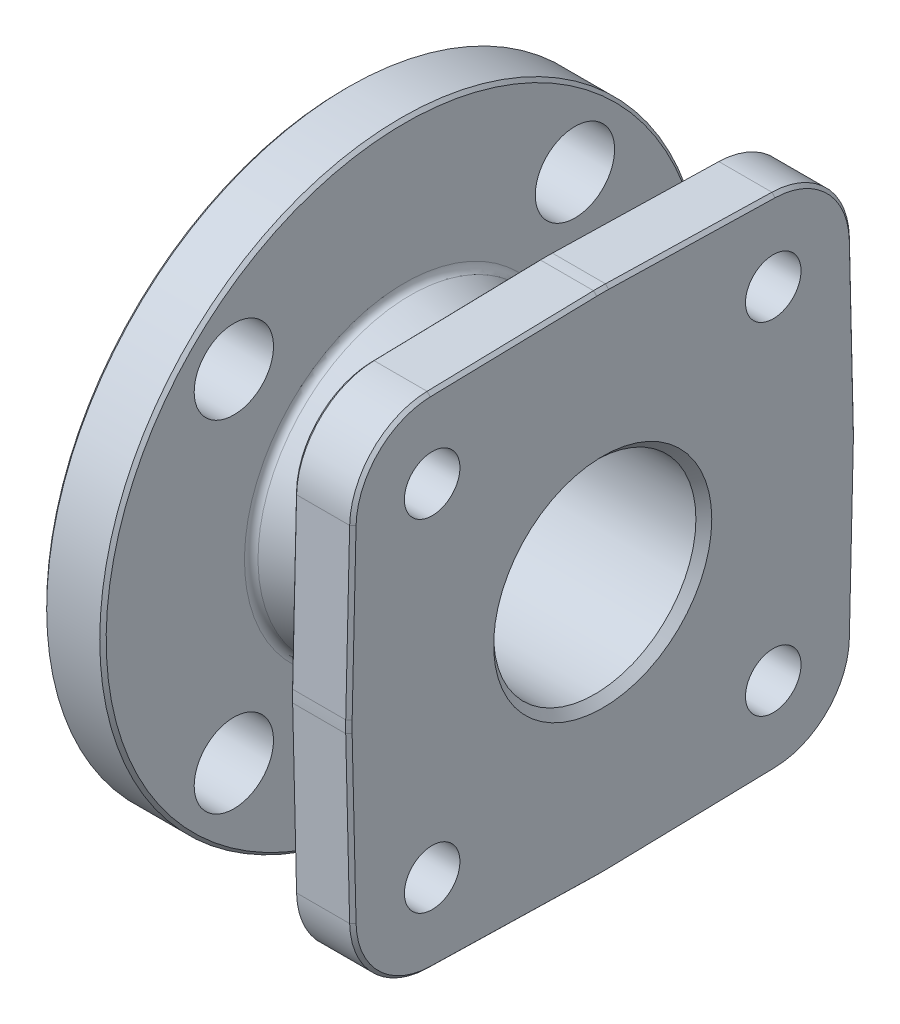
from build123d import *

# Parameters (mm, degrees)
BOSS_EXTRUDE1_DEPTH = 15
HOLE1_D             = 51
HOLE2_D             = 14
HOLE2_DEPTH         = 15
HOLE3_D             = 20
HOLE3_DEPTH         = 15
FILLET1_R           = 2
CHAMFER1_SIZE       = 0.81
CHAMFER2_SIZE       = 2


with BuildPart() as part:
    # Sketch1 → Boss-Extrude1 (new body)
    with BuildSketch(Plane(origin=(0, 0, 0), x_dir=(0, 0, -1), z_dir=(1, 0, 0))):
        with BuildLine():
            Line((-62.994461331, 43.470654948), (-63.982276259, 1.506095834))
            ThreePointArc((-63.982276259, 1.506095834), (-64, 0), (-63.982276259, -1.506095834))
            Line((-63.982276259, -1.506095834), (-62.994461331, -43.470654948))
            ThreePointArc((-62.994461331, -43.470654948), (-57.142135624, -57.142135624), (-43.470654948, -62.994461331))
            Line((-43.470654948, -62.994461331), (-1.506095834, -63.982276259))
            ThreePointArc((-1.506095834, -63.982276259), (0, -64), (1.506095834, -63.982276259))
            Line((1.506095834, -63.982276259), (43.470654948, -62.994461331))
            ThreePointArc((43.470654948, -62.994461331), (57.142135624, -57.142135624), (62.994461331, -43.470654948))
            Line((62.994461331, -43.470654948), (63.982276259, -1.506095834))
            ThreePointArc((63.982276259, -1.506095834), (64, 0), (63.982276259, 1.506095834))
            Line((63.982276259, 1.506095834), (62.994461331, 43.470654948))
            ThreePointArc((62.994461331, 43.470654948), (57.142135624, 57.142135624), (43.470654948, 62.994461331))
            Line((43.470654948, 62.994461331), (1.506095834, 63.982276259))
            ThreePointArc((1.506095834, 63.982276259), (0, 64), (-1.506095834, 63.982276259))
            Line((-1.506095834, 63.982276259), (-43.470654948, 62.994461331))
            ThreePointArc((-43.470654948, 62.994461331), (-57.142135624, 57.142135624), (-62.994461331, 43.470654948))
        make_face()
    extrude(amount=-BOSS_EXTRUDE1_DEPTH)

    # Sketch2 → Revolve1 (revolve)
    with BuildSketch(Plane.XY, mode=Mode.PRIVATE) as revolve1_sk:
        Polygon((-15, 47.5), (-17, 45.5), (-17, 34.5), (-34, 34.5), (-50, 38.787187079), (-50, 76), (-65, 76), (-65, 48), (-67, 46), (-67, 0), (-15, 0), align=None)
    revolve(revolve1_sk.sketch.rotate(Axis((-67, 0, 0), (1, 0, 0)), 180), axis=Axis((-67, 0, 0), (1, 0, 0)))

    # Hole1 (through all)
    with Locations(Plane.ZY.offset(67)):
        with Locations((0, 0)):
            Hole(HOLE1_D / 2)

    # Hole2
    with Locations(Plane(origin=(0, 0, 0), x_dir=(0, 0, -1), z_dir=(1, 0, 0))):
        with Locations((43, 43), (43, -43), (-43, -43), (-43, 43)):
            Hole(HOLE2_D / 2, depth=HOLE2_DEPTH)

    # Hole3
    with Locations(Plane.ZY.offset(65)):
        with Locations((43, 43), (-43, 43), (-43, -43), (43, -43)):
            Hole(HOLE3_D / 2, depth=HOLE3_DEPTH)

    # Fillet1
    fillet1_edges = [part.edges().sort_by_distance(p)[0] for p in [
        (-17, 34.5, 0),
        (-50, 38.787187079, 0),
    ]]
    fillet(fillet1_edges, radius=FILLET1_R)

    # Chamfer1
    chamfer1_edges = [part.edges().sort_by_distance(p)[0] for p in [
        (-15, 0, -64),
        (0, -63.488368795, -22.488375391),
        (0, -64, 0),
        (0, -63.488368795, 22.488375391),
        (-15, 22.488375391, -63.488368795),
        (0, -57.142135624, 57.142135624),
        (0, -22.488375391, 63.488368795),
        (0, 0, 64),
        (0, 22.488375391, 63.488368795),
        (0, 57.142135624, 57.142135624),
        (0, 63.488368795, 22.488375391),
        (0, 64, 0),
        (0, 63.488368795, -22.488375391),
        (0, 57.142135624, -57.142135624),
        (0, 22.488375391, -63.488368795),
        (-15, 57.142135624, -57.142135624),
        (0, 0, -64),
        (0, -22.488375391, -63.488368795),
        (0, -57.142135624, -57.142135624),
        (-15, 63.488368795, -22.488375391),
        (-15, 64, 0),
        (-15, 63.488368795, 22.488375391),
        (-15, 57.142135624, 57.142135624),
        (-15, 22.488375391, 63.488368795),
        (-15, 0, 64),
        (-50, 76, 0),
        (-65, 76, 0),
        (-15, -22.488375391, 63.488368795),
        (-15, -57.142135624, -57.142135624),
        (-15, -57.142135624, 57.142135624),
        (-15, -63.488368795, 22.488375391),
        (-15, -64, 0),
        (-15, -63.488368795, -22.488375391),
        (-15, -22.488375391, -63.488368795),
    ]]
    chamfer(chamfer1_edges, length=CHAMFER1_SIZE)

    # Chamfer2
    chamfer2_edges = [part.edges().sort_by_distance(p)[0] for p in [
        (-67, 0, 25.5),
        (0, 0, 25.5),
    ]]
    chamfer(chamfer2_edges, length=CHAMFER2_SIZE)


solid = part.part
